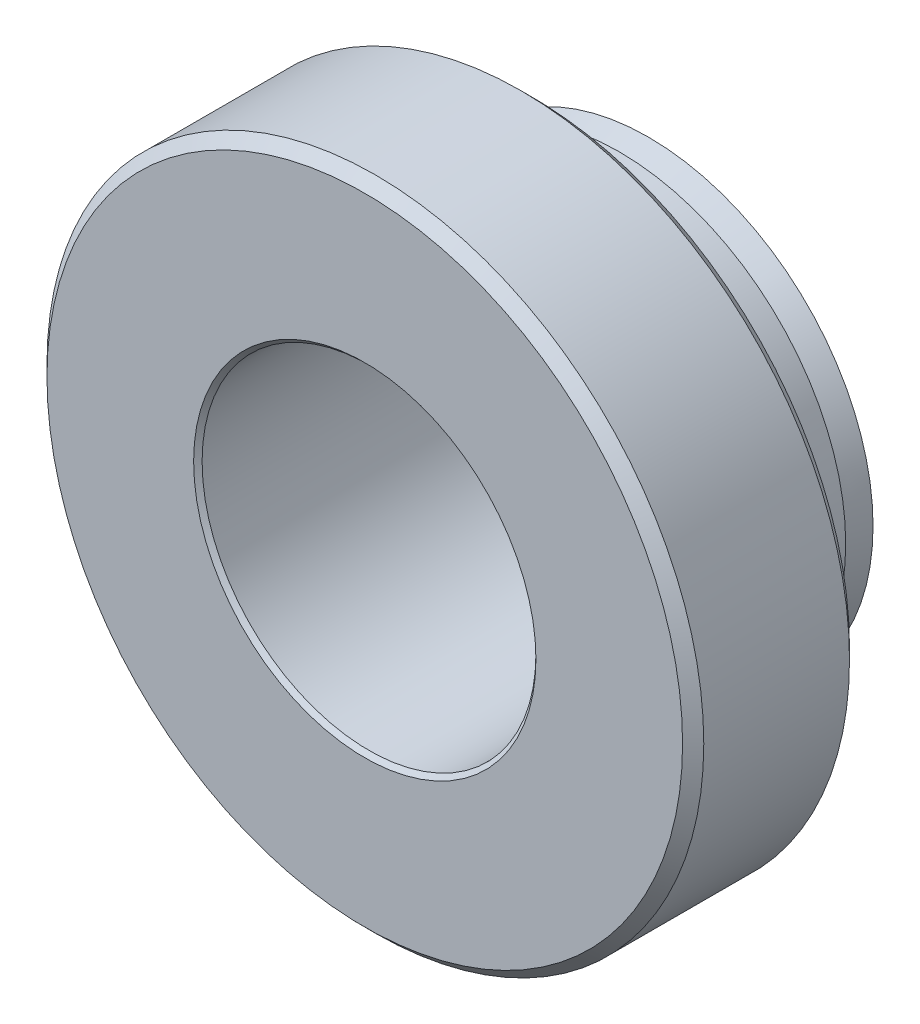
from build123d import *

# Parameters (mm, degrees)
SKETCH1_R           = 3.935
EXTRUDE1_DEPTH      = 2
SKETCH2_R           = 2.7125
EXTRUDE2_DEPTH      = 1.4
SKETCH5_OUTSIDE_W   = 12.452
SKETCH5_OUTSIDE_H   = 12.452
SKETCH5_OUTSIDE_R   = 2.69
CUT_EXTRUDE1_DEPTH  = 0.35
CUT_EXTRUDE1_DRAFT  = 20
CHAMFER2_SIZE       = 0.127
SKETCH7_R           = 2
CUT_EXTRUDE3_DEPTH  = 7.521384056
BOSS_EXTRUDE1_DEPTH = 0.34
CIRPATTERN4_COUNT   = 30


with BuildPart() as part:
    # Sketch1 → Extrude1 (new body)
    with BuildSketch(Plane.XY):
        Circle(SKETCH1_R)
    extrude(amount=-EXTRUDE1_DEPTH)

    # Sketch2 → Extrude2 (add)
    with BuildSketch(Plane(origin=(0, 0, -2), x_dir=(-1, 0, 0), z_dir=(0, 0, -1))):
        Circle(SKETCH2_R)
    extrude(amount=EXTRUDE2_DEPTH)


with BuildPart() as cut_extrude1_tool:
    # Sketch5 outside → Cut-Extrude1 (with draft: the straight prism first)
    with BuildSketch(Plane(origin=(0, 0, -3.4), x_dir=(-1, 0, 0), z_dir=(0, 0, -1))):
        Rectangle(SKETCH5_OUTSIDE_W, SKETCH5_OUTSIDE_H)
        Circle(SKETCH5_OUTSIDE_R, mode=Mode.SUBTRACT)
    extrude(amount=-CUT_EXTRUDE1_DEPTH)
    # Cut-Extrude1: the draft: its side faces are tilted about the plane it starts from
    cut_extrude1_sides = [cut_extrude1_tool.faces().sort_by_distance(p)[0] for p in [
        (0, -6.226, -3.225),
        (-6.226, 0, -3.225),
        (0, 6.226, -3.225),
        (6.226, 0, -3.225),
        (2.69, 0, -3.225),
    ]]
    draft(cut_extrude1_sides, Plane(origin=(0, 0, -3.4), x_dir=(-1, 0, 0), z_dir=(0, 0, -1)), CUT_EXTRUDE1_DRAFT)


with BuildPart() as part_1:
    add(part.part)

    # Cut-Extrude1: cut by cut_extrude1_tool
    add(cut_extrude1_tool.part, mode=Mode.SUBTRACT)

    # Chamfer2
    chamfer2_edges = [part_1.edges().sort_by_distance(p)[0] for p in [
        (-3.935, 0, 0),
        (-3.935, 0, -2),
    ]]
    chamfer(chamfer2_edges, length=CHAMFER2_SIZE)

    # Sketch7 → Cut-Extrude3 (cut, through all)
    with BuildSketch(Plane.XY):
        Circle(SKETCH7_R)
    extrude(amount=-CUT_EXTRUDE3_DEPTH, mode=Mode.SUBTRACT)

    # Cut-Extrude6 cone 1 section (through the dimple's axis) → Cut-Extrude6 (revolve, cut)
    with BuildSketch(Plane(origin=(0, 0, 0), x_dir=(0, -1, 0), z_dir=(1, 0, 0))):
        Polygon((0, 0), (2.0508, 0), (0, 2.0508), align=None)
    revolve(axis=Axis((0, 0, 0), (0, 0, -1)), mode=Mode.SUBTRACT)

    # Cut-Extrude7 cone 1 section (through the dimple's axis) → Cut-Extrude7 (revolve, cut)
    with BuildSketch(Plane(origin=(0, 0, -3.4), x_dir=(0, 1, 0), z_dir=(1, 0, 0))):
        Polygon((0, 0), (2.0635, 0), (0, 2.0635), align=None)
    revolve(axis=Axis((0, 0, -3.4), (0, 0, 1)), mode=Mode.SUBTRACT)

    # Sketch16 → Boss-Extrude1 (add)
    with BuildSketch(Plane(origin=(0, 0, -2), x_dir=(-1, 0, 0), z_dir=(0, 0, -1))):
        with BuildLine():
            Line((0, 3.249), (-0.602777778, 2.644676767))
            ThreePointArc((-0.602777778, 2.644676767), (0, 2.7125), (0.602777778, 2.644676767))
            Line((0.602777778, 2.644676767), (0, 3.249))
        make_face()
    boss_extrude1 = extrude(amount=BOSS_EXTRUDE1_DEPTH)

    # CirPattern4: Boss-Extrude1 ×30 about axis
    cirpattern4_axis = Axis((0, 0, -3.4), (0, 0, -1))
    for i in range(1, CIRPATTERN4_COUNT):
        add(boss_extrude1.rotate(cirpattern4_axis, i * 360 / CIRPATTERN4_COUNT))


solid = part_1.part
